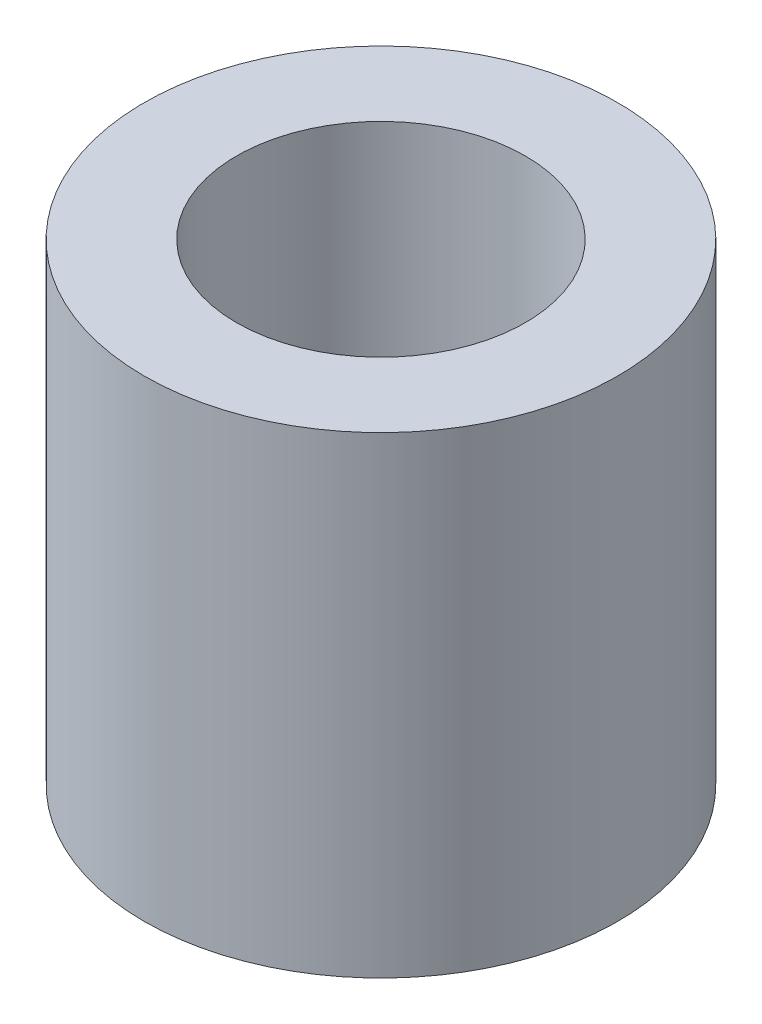
from build123d import *

# Parameters (mm, degrees)
SKETCH1_R           = 10
SKETCH1_R_2         = 6.1
BOSS_EXTRUDE1_DEPTH = 9.975


with BuildPart() as part:
    # Sketch1 → Boss-Extrude1 (new, symmetric)
    with BuildSketch(Plane(origin=(0, 0, 0), x_dir=(1, 0, 0), z_dir=(0, 1, 0))):
        with Locations(Location((0, 0, 0), (0, 0, 270))):
            Circle(SKETCH1_R)
        with Locations(Location((0, 0, 0), (0, 0, 270))):
            Circle(SKETCH1_R_2, mode=Mode.SUBTRACT)
    extrude(amount=BOSS_EXTRUDE1_DEPTH, both=True)


solid = part.part
